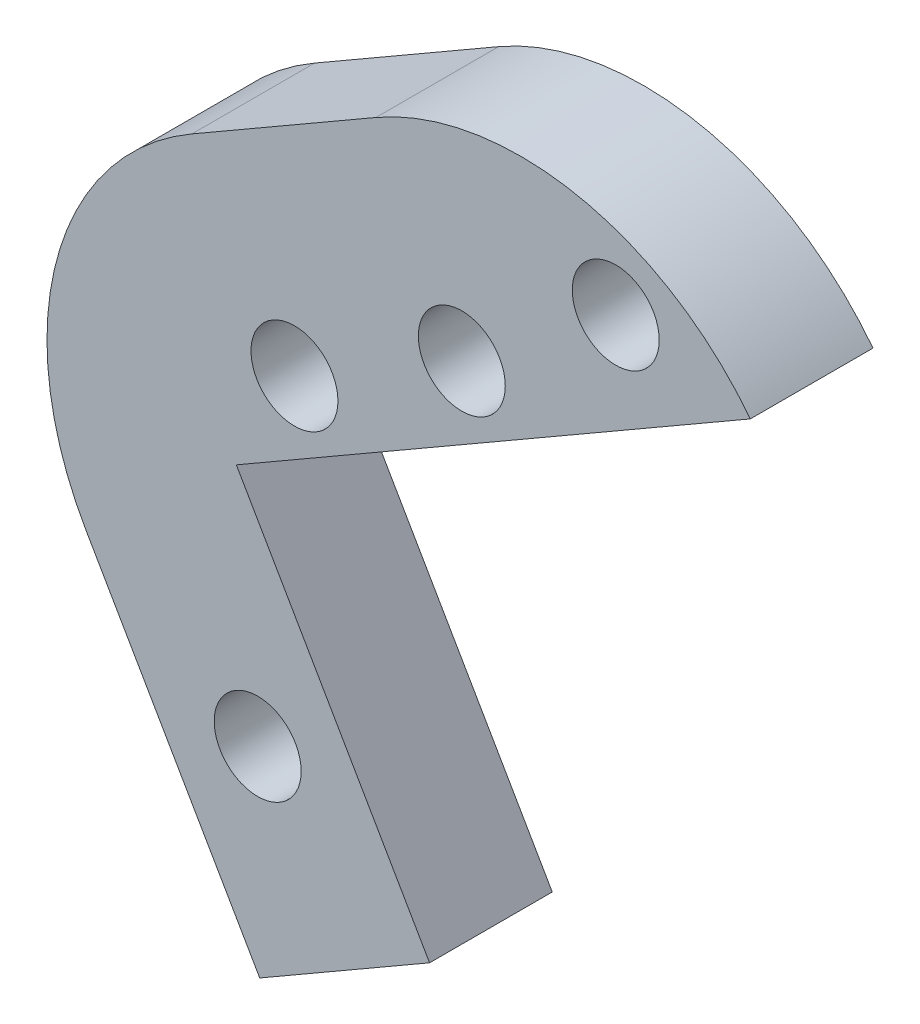
from build123d import *

# Parameters (mm, degrees)
ESQUISSE3_W                   = 53.75
ESQUISSE3_H                   = 73.333333334
BOSS_EXTRU_2_DEPTH            = 6.35
CONG_6_R                      = 20
CONG_7_R                      = 15
ESQUISSE4_R                   = 2.25
ENL_V_MAT_EXTRU_2_DEPTH       = 6.35
SYM_TRIE2_COPY_1_SKETCH_R     = 2.25
SYM_TRIE2_COPY_1_DEPTH        = 6.35
DIAM_TRE_DU_PER_AGE_4_0_4_1_D = 4
ESQUISSE9_OUTSIDE_W           = 257.77
ESQUISSE9_OUTSIDE_H           = 212.77
ENL_V_MAT_EXTRU_3_DEPTH       = 130.491560966
ESQUISSE10_R                  = 2.25
ENL_V_MAT_EXTRU_4_DEPTH       = 130.491560966


with BuildPart() as part:
    # Esquisse3 → Boss.-Extru.2 (new body)
    with BuildSketch(Plane.XY):
        Polygon((-54.672450369, 55), (54.672450369, 55), (71.992958445, 85), (107.5, 64.5), (77.5, 12.538475773), (77.5, -12.538475773), (107.5, -64.5), (71.992958445, -85), (54.672450369, -55), (-54.672450369, -55), (-71.992958445, -85), (-107.5, -64.5), (-77.5, -12.538475773), (-77.5, 12.538475773), (-107.5, 64.5), (-71.992958445, 85), align=None)
        Rectangle(ESQUISSE3_W, ESQUISSE3_H, mode=Mode.SUBTRACT)
    extrude(amount=-BOSS_EXTRU_2_DEPTH)

    # Congé6
    cong_6_edges = [part.edges().sort_by_distance(p)[0] for p in [
        (-54.672450369, 55, -3.175),
        (54.672450369, 55, -3.175),
        (77.5, 12.538475773, -3.175),
        (77.5, -12.538475773, -3.175),
        (54.672450369, -55, -3.175),
        (-54.672450369, -55, -3.175),
        (-77.5, -12.538475773, -3.175),
        (-77.5, 12.538475773, -3.175),
        (-26.875, -36.666666667, -3.175),
        (-26.875, 36.666666667, -3.175),
        (26.875, 36.666666667, -3.175),
        (26.875, -36.666666667, -3.175),
    ]]
    fillet(cong_6_edges, radius=CONG_6_R)

    # Congé7
    cong_7_edges = [part.edges().sort_by_distance(p)[0] for p in [
        (71.992958445, 85, -3.175),
        (107.5, 64.5, -3.175),
        (107.5, -64.5, -3.175),
        (71.992958445, -85, -3.175),
        (-71.992958445, -85, -3.175),
        (-107.5, -64.5, -3.175),
        (-107.5, 64.5, -3.175),
        (-71.992958445, 85, -3.175),
    ]]
    fillet(cong_7_edges, radius=CONG_7_R)

    # Esquisse4 → Enlèv. mat.-Extru.2 (cut)
    with BuildSketch(Plane.XY):
        with Locations((-56.291352203, 26.80402023)):
            Circle(ESQUISSE4_R)
        with Locations((-64.951606241, 21.80402023)):
            Circle(ESQUISSE4_R)
        with Locations((-89.201606241, 63.806252313)):
            Circle(ESQUISSE4_R)
        with Locations((-80.541352203, 68.806252313)):
            Circle(ESQUISSE4_R)
        Polygon((-53.283116293, 32.293602792), (-74.283116293, 68.666669751), (-92.209842152, 58.316669751), (-71.209842152, 21.943602792), align=None)
        with BuildLine():
            Line((-51.695036381, 4.342967697), (-54.695036381, 9.53912012))
            ThreePointArc((-54.695036381, 9.53912012), (-53.871479222, 12.612677278), (-50.797922064, 11.78912012))
            Line((-50.797922064, 11.78912012), (-47.797922064, 6.592967697))
            ThreePointArc((-47.797922064, 6.592967697), (-48.621479222, 3.519410539), (-51.695036381, 4.342967697))
        make_face()
    enl_v_mat_extru_2 = extrude(amount=-ENL_V_MAT_EXTRU_2_DEPTH, mode=Mode.SUBTRACT)

    # Symétrie1: Enlèv. mat.-Extru.2 across plane
    add(enl_v_mat_extru_2.mirror(Plane.ZX), mode=Mode.SUBTRACT)

    # Symétrie2: Enlèv. mat.-Extru.2 across plane
    add(enl_v_mat_extru_2.mirror(Plane(origin=(0, 0, 0), x_dir=(0, 0, 1), z_dir=(1, 0, 0))), mode=Mode.SUBTRACT)

    # Symétrie2 copy 1 sketch → Symétrie2 copy 1 (cut)
    with BuildSketch(Plane(origin=(0, 0, 0), x_dir=(-1, 0, 0), z_dir=(0, 0, 1))):
        with Locations((-56.291352203, 26.80402023)):
            Circle(SYM_TRIE2_COPY_1_SKETCH_R)
        with Locations((-64.951606241, 21.80402023)):
            Circle(SYM_TRIE2_COPY_1_SKETCH_R)
        with Locations((-89.201606241, 63.806252313)):
            Circle(SYM_TRIE2_COPY_1_SKETCH_R)
        with Locations((-80.541352203, 68.806252313)):
            Circle(SYM_TRIE2_COPY_1_SKETCH_R)
        Polygon((-53.283116293, 32.293602792), (-74.283116293, 68.666669751), (-92.209842152, 58.316669751), (-71.209842152, 21.943602792), align=None)
        with BuildLine():
            Line((-51.695036381, 4.342967697), (-54.695036381, 9.53912012))
            ThreePointArc((-54.695036381, 9.53912012), (-53.871479222, 12.612677278), (-50.797922064, 11.78912012))
            Line((-50.797922064, 11.78912012), (-47.797922064, 6.592967697))
            ThreePointArc((-47.797922064, 6.592967697), (-48.621479222, 3.519410539), (-51.695036381, 4.342967697))
        make_face()
    extrude(amount=-SYM_TRIE2_COPY_1_DEPTH, mode=Mode.SUBTRACT)

    # Diamètre du perçage Ø4.0 (4)1 (through all)
    with Locations(Plane.XY):
        with Locations((33, 48), (-33, 48), (-33, -48), (33, -48)):
            Hole(DIAM_TRE_DU_PER_AGE_4_0_4_1_D / 2)

    # Esquisse9 outside → Enlèv. mat.-Extru.3 (cut, through all)
    with BuildSketch(Plane.XY):
        Rectangle(ESQUISSE9_OUTSIDE_W, ESQUISSE9_OUTSIDE_H)
        with BuildLine():
            Line((-65.608946312, 73.674704124), (-92.209842152, 58.316669751))
            Line((-92.209842152, 58.316669751), (-82.209842152, 40.996161675))
            Line((-82.209842152, 40.996161675), (-91, 35.921161675))
            Line((-91, 35.921161675), (-100, 51.509618943))
            ThreePointArc((-100, 51.509618943), (-101.498506338, 62.89190462), (-94.509618943, 72))
            Line((-94.509618943, 72), (-84.983339502, 77.5))
            ThreePointArc((-84.983339502, 77.5), (-74.577818709, 79.225526966), (-65.608946312, 73.674704124))
        make_face(mode=Mode.SUBTRACT)
    extrude(amount=-ENL_V_MAT_EXTRU_3_DEPTH, mode=Mode.SUBTRACT)

    # Esquisse10 → Enlèv. mat.-Extru.4 (cut, through all)
    with BuildSketch(Plane.XY):
        with Locations((-91.104921076, 46.252890309)):
            Circle(ESQUISSE10_R)
        with Locations((-72.574022775, 74.849567776)):
            Circle(ESQUISSE10_R)
    extrude(amount=-ENL_V_MAT_EXTRU_4_DEPTH, mode=Mode.SUBTRACT)


solid = part.part
